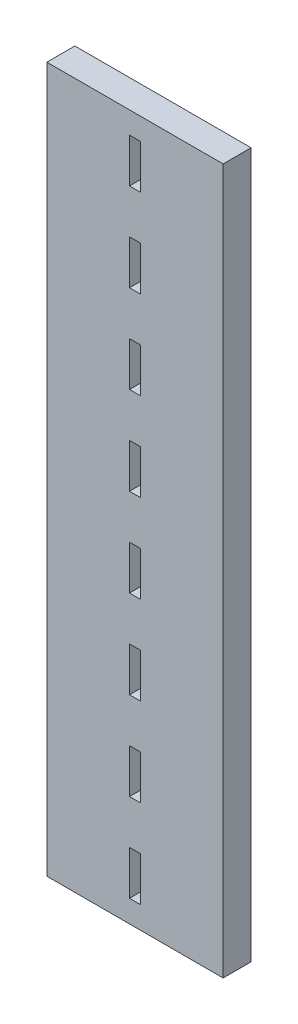
from build123d import *

# Parameters (mm, degrees)
SKETCH1_W           = 10
SKETCH1_H           = 40
SKETCH1_W_2         = 0.625
SKETCH1_H_2         = 2.5
BOSS_EXTRUDE2_DEPTH = 1.5875


with BuildPart() as part:
    # Sketch1 → Boss-Extrude2 (new body)
    with BuildSketch(Plane.XY):
        with Locations((5, 20)):
            Rectangle(SKETCH1_W, SKETCH1_H)
        with Locations((5, 32.51)):
            Rectangle(SKETCH1_W_2, SKETCH1_H_2, mode=Mode.SUBTRACT)
        with Locations((5, 27.51)):
            Rectangle(SKETCH1_W_2, SKETCH1_H_2, mode=Mode.SUBTRACT)
        with Locations((5, 22.51)):
            Rectangle(SKETCH1_W_2, SKETCH1_H_2, mode=Mode.SUBTRACT)
        with Locations((5, 17.51)):
            Rectangle(SKETCH1_W_2, SKETCH1_H_2, mode=Mode.SUBTRACT)
        with Locations((5, 12.51)):
            Rectangle(SKETCH1_W_2, SKETCH1_H_2, mode=Mode.SUBTRACT)
        with Locations((5, 7.51)):
            Rectangle(SKETCH1_W_2, SKETCH1_H_2, mode=Mode.SUBTRACT)
        with Locations((5, 2.51)):
            Rectangle(SKETCH1_W_2, SKETCH1_H_2, mode=Mode.SUBTRACT)
        with Locations((5, 37.51)):
            Rectangle(SKETCH1_W_2, SKETCH1_H_2, mode=Mode.SUBTRACT)
    extrude(amount=BOSS_EXTRUDE2_DEPTH)


solid = part.part
